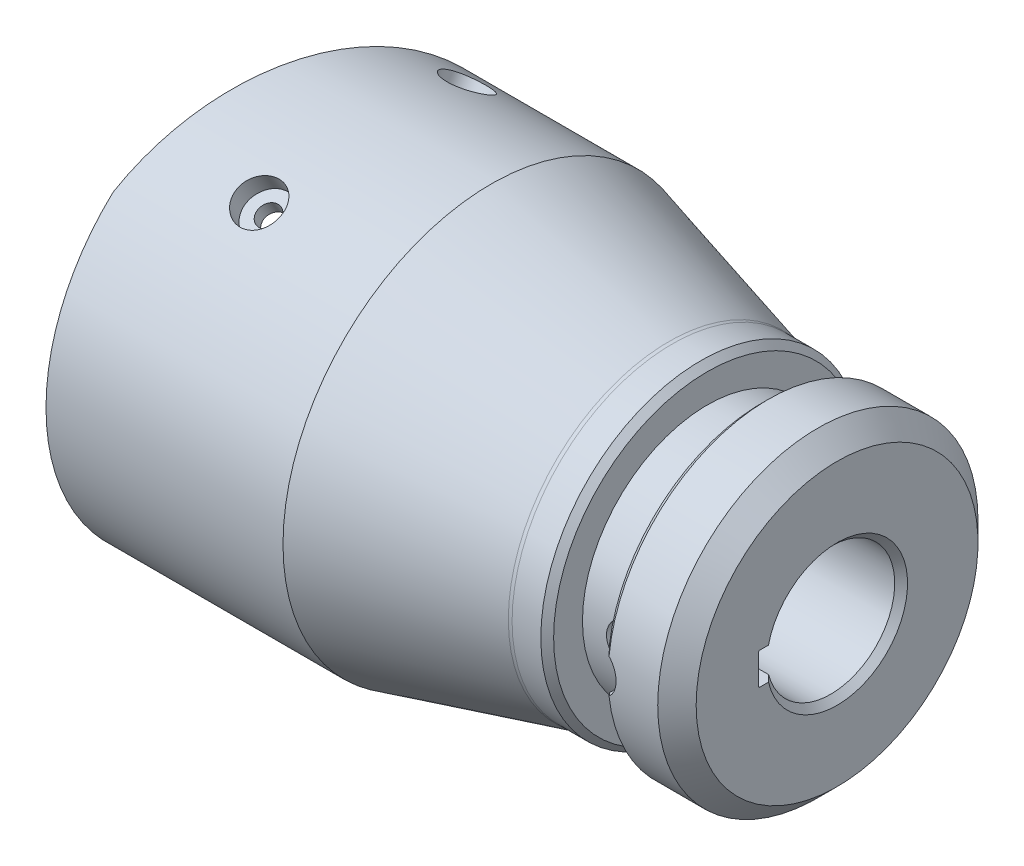
from build123d import *

# Parameters (mm, degrees)
CUT_EXTRUDE_12_DEPTH      = 102.948516419
CUT_EXTRUDE_12_DEPTH_BACK = 102.948516419
CUT_EXTRUDE_START         = 61
CUT_EXTRUDE_5_R0_25_DEPTH = 31


with BuildPart() as part:
    # Эскиз1 → Revolve 289 (revolve)
    with BuildSketch(Plane.XY, mode=Mode.PRIVATE) as revolve_289_sk:
        with BuildLine():
            Line((0, 32.5), (37, 32.5))
            Line((37, 32.5), (64.745695, 25.068113))
            ThreePointArc((64.745695, 25.068113), (65.002224223, 25.017098236), (65.263217049, 24.999995817))
            Line((65.263217049, 24.999995817), (69.749999449, 24.999995817))
            Line((69.749999449, 24.999995817), (70.749999449, 23.999995817))
            Line((70.749999449, 23.999995817), (70.749999449, 19.499995817))
            Line((70.749999449, 19.499995817), (79.25, 19.499995817))
            Line((79.25, 19.499995817), (79.25, 24))
            Line((79.25, 24), (80.25, 25))
            Line((80.25, 25), (88, 25))
            Line((88, 25), (91, 22))
            Line((91, 22), (91, 11))
            Line((91, 11), (90, 10))
            Line((90, 10), (61, 10))
            Line((61, 10), (61, 19))
            ThreePointArc((61, 19), (60.707106781, 19.707106781), (60, 20))
            Line((60, 20), (25, 20))
            Line((25, 20), (25, 27.1))
            ThreePointArc((25, 27.1), (24.882842712, 27.382842712), (24.6, 27.5))
            Line((24.6, 27.5), (0, 27.5))
            Line((0, 27.5), (0, 32.5))
        make_face()
    revolve(revolve_289_sk.sketch.rotate(Axis((0, 0, 0), (1, 0, 0)), 90), axis=Axis((0, 0, 0), (1, 0, 0)))

    # Эскиз2 → Наклон торца 12 градусов (cut, two sides: drawn at the far end of the back side and taken through both)
    with BuildSketch(Plane(origin=(0, 0, 0), x_dir=(1, 0, 0), z_dir=(0, 1, 0)).offset(-CUT_EXTRUDE_12_DEPTH_BACK)):
        Polygon((-25, 50), (15.30407244, 50), (-5.951583727, -50), (-25, -50), align=None)
    extrude(amount=CUT_EXTRUDE_12_DEPTH + CUT_EXTRUDE_12_DEPTH_BACK, mode=Mode.SUBTRACT)

    # Эскиз3 → Паз 5 R0.25 (cut)
    with BuildSketch(Plane(origin=(0, 0, 0), x_dir=(0, 0, -1), z_dir=(1, 0, 0)).offset(CUT_EXTRUDE_START)):
        with BuildLine():
            Line((0, -2.5), (0, 2.5))
            Line((0, 2.5), (-12.05, 2.5))
            ThreePointArc((-12.05, 2.5), (-12.226776695, 2.426776695), (-12.3, 2.25))
            Line((-12.3, 2.25), (-12.3, -2.25))
            ThreePointArc((-12.3, -2.25), (-12.226776695, -2.426776695), (-12.05, -2.5))
            Line((-12.05, -2.5), (0, -2.5))
        make_face()
    extrude(amount=CUT_EXTRUDE_5_R0_25_DEPTH, mode=Mode.SUBTRACT)

    # Эскиз4 → Cut-Revolve M4 30 -1 (revolve, cut)
    with BuildSketch(Plane(origin=(0, 0, 0), x_dir=(1, 0, 0), z_dir=(0, -0.49999999999999994, 0.8660254037844387)), mode=Mode.PRIVATE) as cut_revolve_m4_30_1_sk:
        Polygon((17, -26), (18.7, -26), (18.7, -29.5), (20.5, -29.5), (20.5, -40), (17, -40), align=None)
    revolve(cut_revolve_m4_30_1_sk.sketch.rotate(Axis((17, -17.320508076, -10), (0, -0.8660254037844387, -0.49999999999999994)), 90), axis=Axis((17, -17.320508076, -10), (0, -0.8660254037844387, -0.49999999999999994)), mode=Mode.SUBTRACT)

    # Эскиз5 → Cut-Revolve M4 30 1 2 (revolve, cut)
    with BuildSketch(Plane(origin=(0, 0, 0), x_dir=(1, 0, 0), z_dir=(0, -0.49999999999999994, 0.8660254037844387)), mode=Mode.PRIVATE) as cut_revolve_m4_30_1_2_sk:
        Polygon((17, 26), (18.7, 26), (18.7, 29.5), (20.5, 29.5), (20.5, 40), (17, 40), align=None)
    revolve(cut_revolve_m4_30_1_2_sk.sketch.rotate(Axis((17, 17.320508076, 10), (0, 0.8660254037844387, 0.49999999999999994)), 90), axis=Axis((17, 17.320508076, 10), (0, 0.8660254037844387, 0.49999999999999994)), mode=Mode.SUBTRACT)

    # Эскиз6 → Cut-Revolve M4 150 -1 (revolve, cut)
    with BuildSketch(Plane(origin=(0, 0, 0), x_dir=(1, 0, 0), z_dir=(0, -0.49999999999999994, -0.8660254037844387)), mode=Mode.PRIVATE) as cut_revolve_m4_150_1_sk:
        Polygon((17, -26), (18.7, -26), (18.7, -29.5), (20.5, -29.5), (20.5, -40), (17, -40), align=None)
    revolve(cut_revolve_m4_150_1_sk.sketch.rotate(Axis((17, 17.320508076, -10), (0, 0.8660254037844387, -0.49999999999999994)), 90), axis=Axis((17, 17.320508076, -10), (0, 0.8660254037844387, -0.49999999999999994)), mode=Mode.SUBTRACT)

    # Эскиз7 → Cut-Revolve M4 150 1 2 (revolve, cut)
    with BuildSketch(Plane(origin=(0, 0, 0), x_dir=(1, 0, 0), z_dir=(0, -0.49999999999999994, -0.8660254037844387)), mode=Mode.PRIVATE) as cut_revolve_m4_150_1_2_sk:
        Polygon((17, 26), (18.7, 26), (18.7, 29.5), (20.5, 29.5), (20.5, 40), (17, 40), align=None)
    revolve(cut_revolve_m4_150_1_2_sk.sketch.rotate(Axis((17, -17.320508076, 10), (0, -0.8660254037844387, 0.49999999999999994)), 90), axis=Axis((17, -17.320508076, 10), (0, -0.8660254037844387, 0.49999999999999994)), mode=Mode.SUBTRACT)

    # Эскиз8 → Радиальное отверстие 3.6 цековка 7 (revolve, cut)
    with BuildSketch(Plane(origin=(0, 0, 0), x_dir=(1, 0, 0), z_dir=(0, 1, 0)), mode=Mode.PRIVATE) as cut_revolve_3_6_7_sk:
        Polygon((78, -8), (79.8, -8), (79.8, -15), (81.5, -15), (81.5, -35), (78, -35), align=None)
    revolve(cut_revolve_3_6_7_sk.sketch.rotate(Axis((78, 0, 0), (0, 0, 1)), 180), axis=Axis((78, 0, 0), (0, 0, 1)), mode=Mode.SUBTRACT)


solid = part.part
